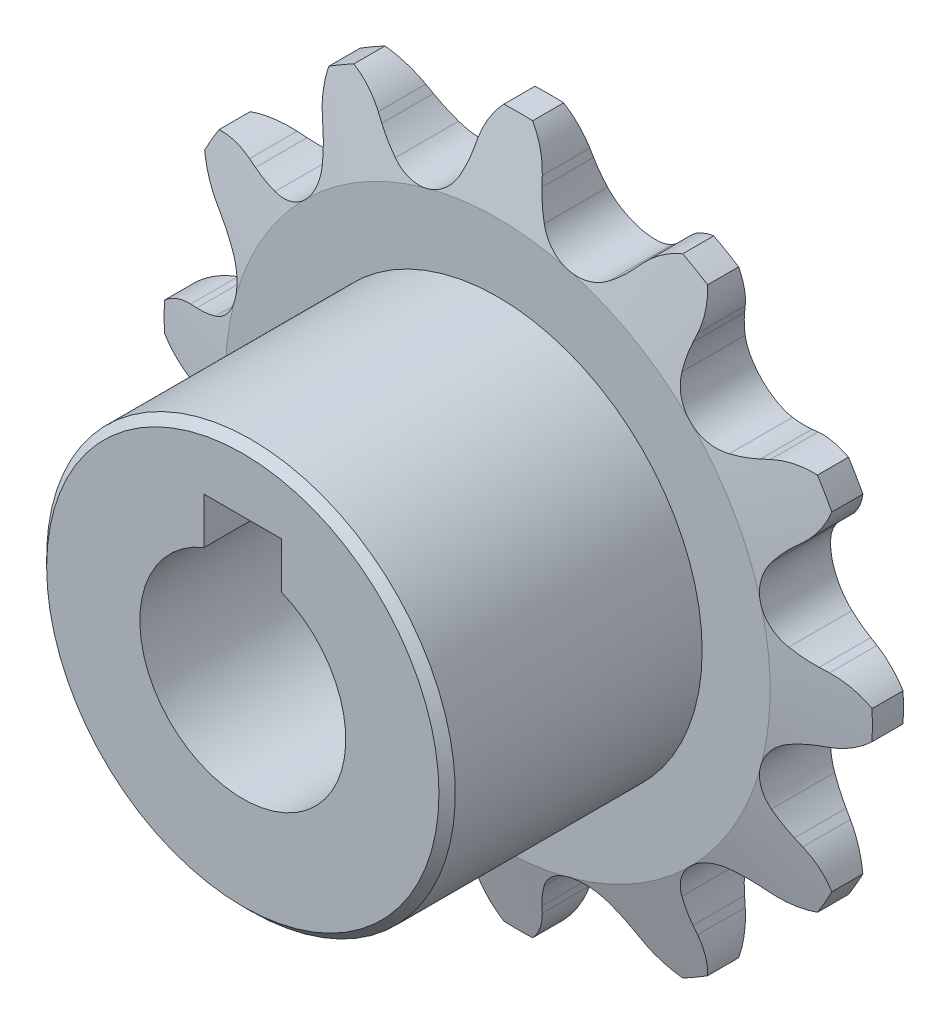
from build123d import *

# Parameters (mm, degrees)
CUT_EXTRUDE1_DEPTH      = 20.501564491
CIRPATTERN1_COUNT       = 12
BOSS_EXTRUDE1_START     = 1.397
SKETCH2_R               = 7.9375
BOSS_EXTRUDE1_DEPTH     = 9.906
CUT_EXTRUDE2_DEPTH      = 23.497049209
CUT_EXTRUDE2_DEPTH_BACK = 23.497049209
SKETCH3_R               = 3.175
SKETCH4_W               = 2.0955
SKETCH4_H               = 5.461
CUT_EXTRUDE4_DEPTH      = 24.230355499


with BuildPart() as part:
    # Sketch1 → Revolve1 (revolve)
    with BuildSketch(Plane(origin=(0, 0, 0), x_dir=(0, 0, -1), z_dir=(1, 0, 0)), mode=Mode.PRIVATE) as revolve1_sk:
        Polygon((1.397, 0), (-1.397, 0), (-1.397, 10.579261314), (-0.60325, 13.754261314), (0.60325, 13.754261314), (1.397, 10.579261314), align=None)
    revolve(revolve1_sk.sketch.rotate(Axis((0, 0, -1.397), (0, 0, 1)), 90), axis=Axis((0, 0, -1.397), (0, 0, 1)))

    # Sketch0 → Cut-Extrude1 (cut, symmetric)
    with BuildSketch(Plane.XY):
        with BuildLine():
            Line((5.117617163, -11.371857705), (4.901148654, -11.128614009))
            ThreePointArc((4.901148654, -11.128614009), (4.544359831, -10.771825186), (4.148562832, -10.458869496))
            ThreePointArc((4.148562832, -10.458869496), (2.7356922, -10.209742283), (1.636673946, -11.131928094))
            ThreePointArc((1.636673946, -11.131928094), (1.450381536, -11.600854172), (1.319787763, -12.088236768))
            Line((1.319787763, -12.088236768), (1.253942383, -12.407126242))
            ThreePointArc((1.253942383, -12.407126242), (0.161394669, -14.090046377), (-1.782387416, -14.587632443))
            ThreePointArc((-1.782387416, -14.587632443), (3.803635588, -14.195361268), (8.837409003, -11.742066569))
            ThreePointArc((8.837409003, -11.742066569), (6.905251305, -12.283035437), (5.117617163, -11.371857705))
        make_face()
    cut_extrude1 = extrude(amount=CUT_EXTRUDE1_DEPTH, both=True, mode=Mode.SUBTRACT)

    # CirPattern1: Cut-Extrude1 ×12 about axis
    cirpattern1_axis = Axis((0, 0, 0), (0, 0, 1))
    for i in range(1, CIRPATTERN1_COUNT):
        add(cut_extrude1.rotate(cirpattern1_axis, i * 360 / CIRPATTERN1_COUNT), mode=Mode.SUBTRACT)

    # Sketch2 → Boss-Extrude1 (add)
    with BuildSketch(Plane.XY.offset(BOSS_EXTRUDE1_START)):
        Circle(SKETCH2_R)
    extrude(amount=BOSS_EXTRUDE1_DEPTH)

    # Sketch3 → Cut-Extrude2 (cut, two sides: drawn at the far end of the back side and taken through both)
    with BuildSketch(Plane.XY.offset(-CUT_EXTRUDE2_DEPTH_BACK)):
        with Locations(Location((0, 0, 0), (0, 0, 180))):
            Circle(SKETCH3_R)
    extrude(amount=CUT_EXTRUDE2_DEPTH + CUT_EXTRUDE2_DEPTH_BACK, mode=Mode.SUBTRACT)

    # Sketch4 → Cut-Revolve1 (revolve, cut)
    with BuildSketch(Plane(origin=(0, 0, 0), x_dir=(0, 0, -1), z_dir=(1, 0, 0))):
        Polygon((-11.303, 7.9375), (-11.303, 7.62), (-10.9855, 7.9375), align=None)
        with Locations((-2.44475, 11.023761314)):
            Rectangle(SKETCH4_W, SKETCH4_H)
    revolve(axis=Axis((0, 0, -1.397), (0, 0, 1)), mode=Mode.SUBTRACT)

    # Sketch5 → Cut-Extrude4 (cut, through all)
    with BuildSketch(Plane.XY.offset(11.303)):
        with BuildLine():
            ThreePointArc((3.175, 0), (-1.630663209, -2.724254485), (-1.5, 2.798325392))
            Line((-1.5, 2.798325392), (-1.5, 3.708099244))
            ThreePointArc((-1.5, 3.708099244), (-2.236067977, -3.31662479), (4, 0))
            ThreePointArc((4, 0), (3.31662479, 2.236067977), (1.5, 3.708099244))
            Line((1.5, 3.708099244), (1.5, 2.798325392))
            ThreePointArc((1.5, 2.798325392), (2.724254485, 1.630663209), (3.175, 0))
        make_face()
        with BuildLine():
            Line((-1.5, 3.708099244), (-1.5, 2.798325392))
            ThreePointArc((-1.5, 2.798325392), (0, 3.175), (1.5, 2.798325392))
            Line((1.5, 2.798325392), (1.5, 3.708099244))
            ThreePointArc((1.5, 3.708099244), (0, 4), (-1.5, 3.708099244))
        make_face()
        with BuildLine():
            Line((-1.5, 5.5), (-1.5, 3.708099244))
            ThreePointArc((-1.5, 3.708099244), (0, 4), (1.5, 3.708099244))
            Line((1.5, 3.708099244), (1.5, 5.5))
            Line((1.5, 5.5), (-1.5, 5.5))
        make_face()
        with BuildLine():
            Line((-1.5, 2.798325392), (-1.5, 2.5))
            Line((-1.5, 2.5), (1.5, 2.5))
            Line((1.5, 2.5), (1.5, 2.798325392))
            ThreePointArc((1.5, 2.798325392), (0, 3.175), (-1.5, 2.798325392))
        make_face()
        with BuildLine():
            Line((1.5, 2.5), (-1.5, 2.5))
            Line((-1.5, 2.5), (-1.5, 2.798325392))
            ThreePointArc((-1.5, 2.798325392), (-1.630663209, -2.724254485), (3.175, 0))
            ThreePointArc((3.175, 0), (2.724254485, 1.630663209), (1.5, 2.798325392))
            Line((1.5, 2.798325392), (1.5, 2.5))
        make_face()
    extrude(amount=-CUT_EXTRUDE4_DEPTH, mode=Mode.SUBTRACT)


solid = part.part
